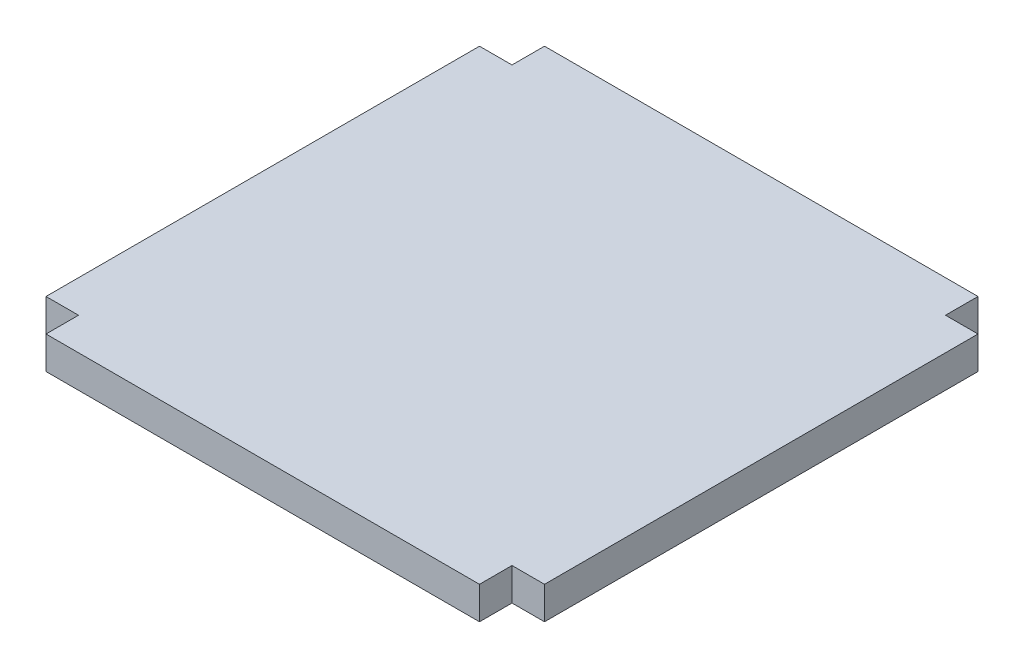
from build123d import *

# Parameters (mm, degrees)
EXTRUDE_1_DEPTH = 15


with BuildPart() as part:
    # 草图1 → 凸台-拉伸1 (new body)
    with BuildSketch(Plane(origin=(0, 0, 0), x_dir=(1, 0, 0), z_dir=(0, 1, 0))):
        Polygon((-115, 100), (-100, 100), (-100, 115), (100, 115), (100, 100), (115, 100), (115, -100), (100, -100), (100, -115), (-100, -115), (-100, -100), (-115, -100), align=None)
    extrude(amount=EXTRUDE_1_DEPTH)


solid = part.part
